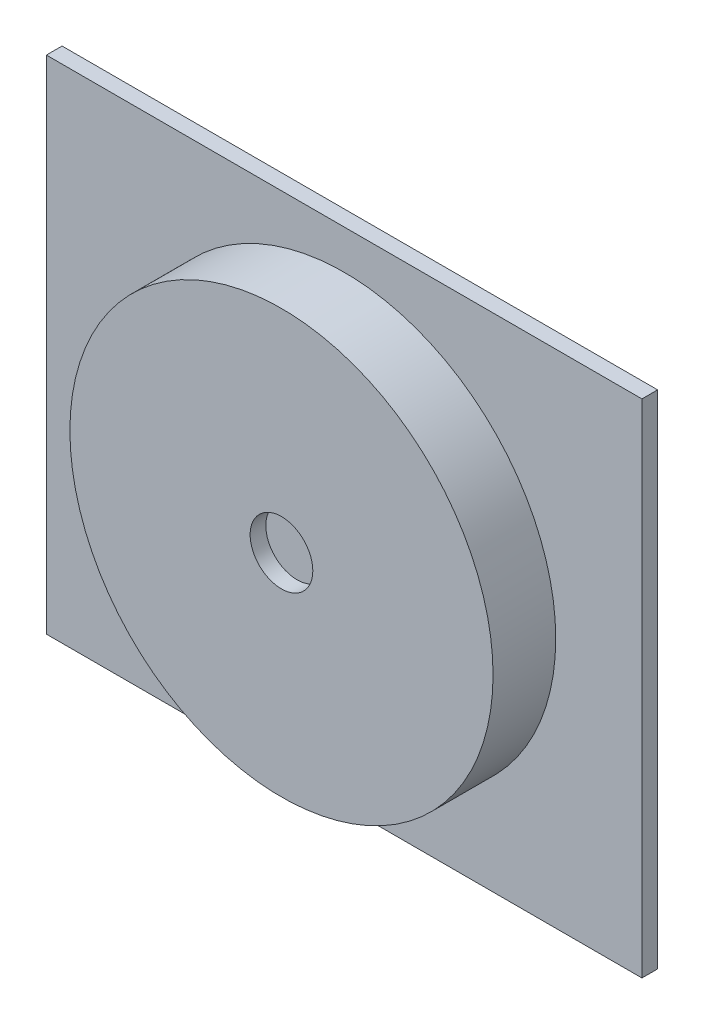
from build123d import *

# Parameters (mm, degrees)
SKETCH1_W           = 38
SKETCH1_H           = 32
BOSS_EXTRUDE1_DEPTH = 1
SKETCH2_R           = 13.5
BOSS_EXTRUDE2_DEPTH = 4
SKETCH3_R           = 2
CUT_EXTRUDE1_DEPTH  = 1


with BuildPart() as part:
    # Sketch1 → Boss-Extrude1 (new body)
    with BuildSketch(Plane.XY):
        with Locations((-3.055803571, -4.102678571)):
            Rectangle(SKETCH1_W, SKETCH1_H)
    extrude(amount=BOSS_EXTRUDE1_DEPTH)

    # Sketch2 → Boss-Extrude2 (add)
    with BuildSketch(Plane.XY.offset(1)):
        with Locations((-3.055803571, -4.102678571)):
            Circle(SKETCH2_R)
    extrude(amount=BOSS_EXTRUDE2_DEPTH)

    # Sketch3 → Cut-Extrude1 (cut)
    with BuildSketch(Plane.XY.offset(5)):
        with Locations((-3.055803571, -4.102678571)):
            Circle(SKETCH3_R)
    extrude(amount=-CUT_EXTRUDE1_DEPTH, mode=Mode.SUBTRACT)


solid = part.part
